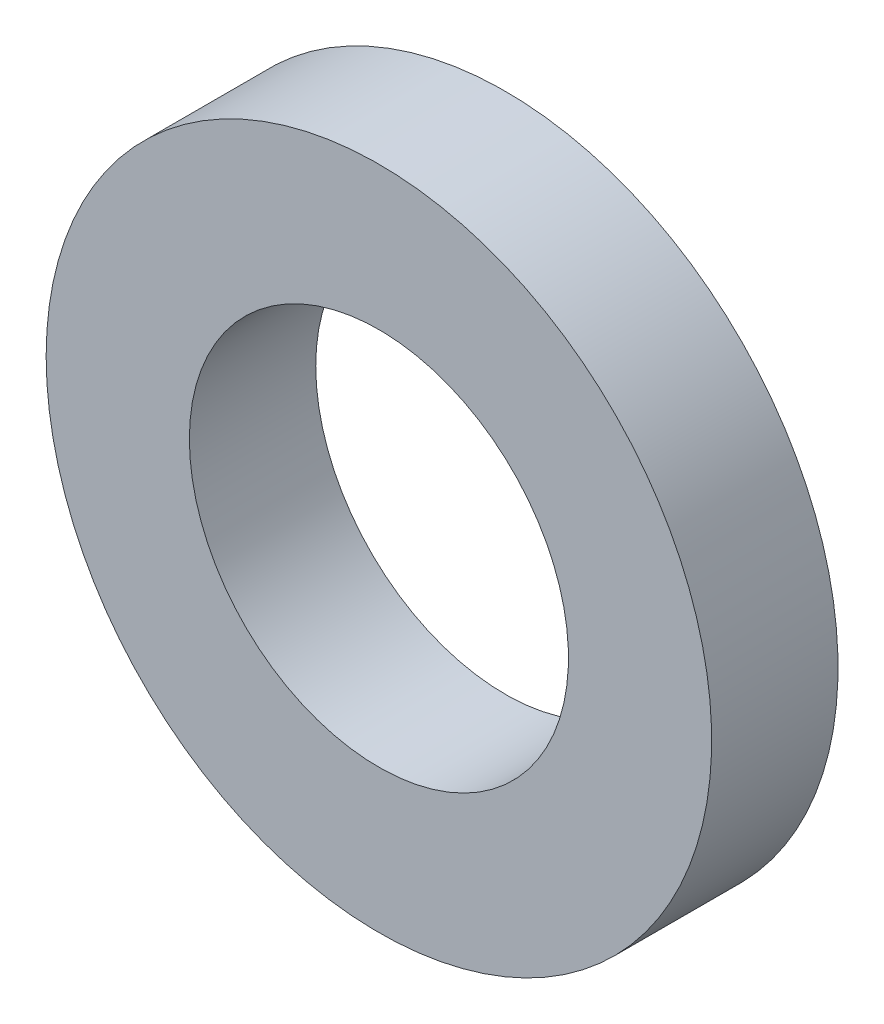
from build123d import *

# Parameters (mm, degrees)
SKETCH1_R      = 7.9
SKETCH1_R_2    = 4.5
EXTRUDE1_DEPTH = 3


with BuildPart() as part:
    # Sketch1 → Extrude1 (new body)
    with BuildSketch(Plane.XY):
        with Locations(Location((0, 0, 0), (0, 0, 180))):
            Circle(SKETCH1_R)
        with Locations(Location((0, 0, 0), (0, 0, 180))):
            Circle(SKETCH1_R_2, mode=Mode.SUBTRACT)
    extrude(amount=EXTRUDE1_DEPTH)


solid = part.part
